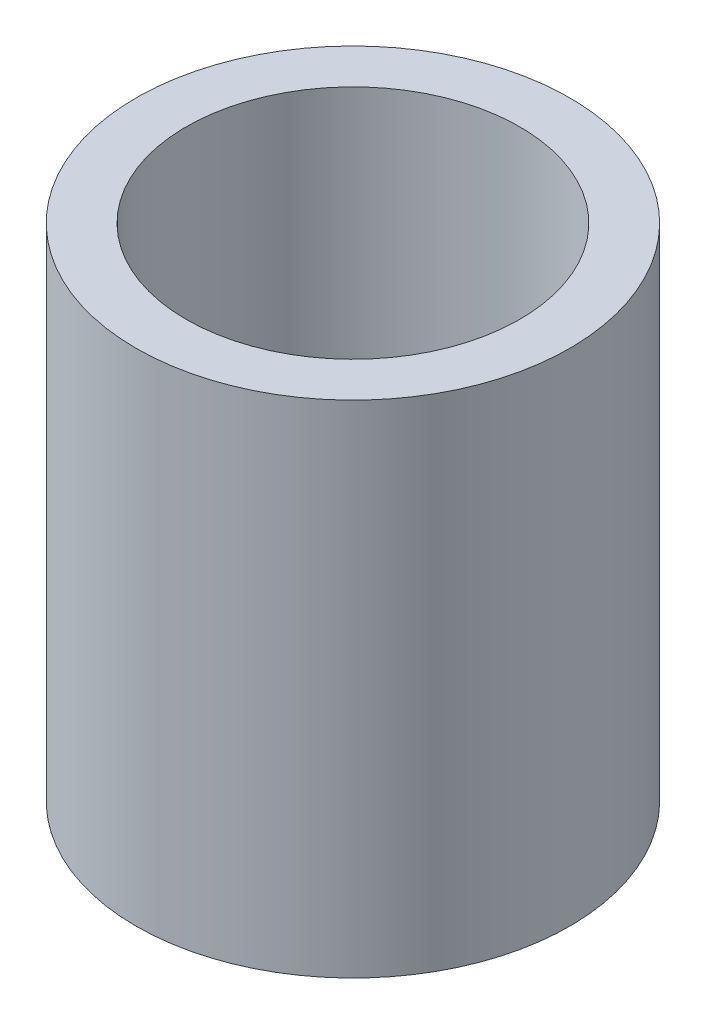
from build123d import *

# Parameters (mm, degrees)
SKETCH1_R           = 2.6
SKETCH1_R_2         = 2
BOSS_EXTRUDE1_DEPTH = 6


with BuildPart() as part:
    # Sketch1 → Boss-Extrude1 (new body)
    with BuildSketch(Plane(origin=(0, 0, 0), x_dir=(1, 0, 0), z_dir=(0, 1, 0))):
        with Locations(Location((0, 0, 0), (0, 0, 270))):
            Circle(SKETCH1_R)
        with Locations(Location((0, 0, 0), (0, 0, 270))):
            Circle(SKETCH1_R_2, mode=Mode.SUBTRACT)
    extrude(amount=BOSS_EXTRUDE1_DEPTH)


solid = part.part
